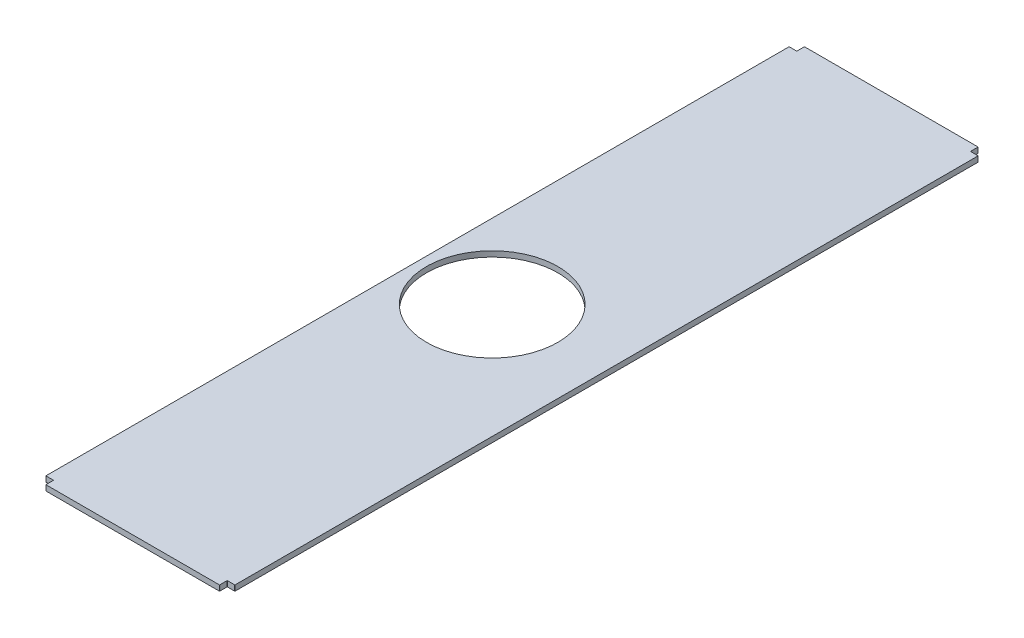
from build123d import *

# Parameters (mm, degrees)
SKETCH1_W           = 219.202
SKETCH1_H           = 879.7036
BOSS_EXTRUDE1_DEPTH = 6.35
SKETCH4_R           = 76.2
SKETCH4_W           = 8.89
SKETCH4_H           = 8.89
CUT_EXTRUDE3_DEPTH  = 907.624653954
FILLET1_R           = 0.254


with BuildPart() as part:
    # Sketch1 → Boss-Extrude1 (new body)
    with BuildSketch(Plane(origin=(0, 0, 0), x_dir=(1, 0, 0), z_dir=(0, 1, 0))):
        with Locations((109.601, 439.8518)):
            Rectangle(SKETCH1_W, SKETCH1_H)
    extrude(amount=BOSS_EXTRUDE1_DEPTH)

    # Sketch4 → Cut-Extrude3 (cut, through all)
    with BuildSketch(Plane(origin=(0, 6.35, 0), x_dir=(1, 0, 0), z_dir=(0, 1, 0))):
        with Locations(Location((86.6394, 439.8518, 0), (0, 0, 270))):
            Circle(SKETCH4_R)
        with Locations((4.445, 4.445)):
            Rectangle(SKETCH4_W, SKETCH4_H)
        with Locations((214.757, 4.445)):
            Rectangle(SKETCH4_W, SKETCH4_H)
        with Locations((214.757, 875.2586)):
            Rectangle(SKETCH4_W, SKETCH4_H)
        with Locations((4.445, 875.2586)):
            Rectangle(SKETCH4_W, SKETCH4_H)
    extrude(amount=-CUT_EXTRUDE3_DEPTH, mode=Mode.SUBTRACT)

    # Fillet1
    fillet1_edges = [part.edges().sort_by_distance(p)[0] for p in [
        (0, 3.175, -870.8136),
        (8.89, 3.175, -879.7036),
        (8.89, 3.175, -870.8136),
        (219.202, 3.175, -870.8136),
        (210.312, 3.175, -870.8136),
        (210.312, 3.175, -879.7036),
        (219.202, 3.175, -8.89),
        (210.312, 3.175, 0),
        (210.312, 3.175, -8.89),
        (0, 3.175, -8.89),
        (8.89, 3.175, -8.89),
        (8.89, 3.175, 0),
    ]]
    fillet(fillet1_edges, radius=FILLET1_R)


solid = part.part
